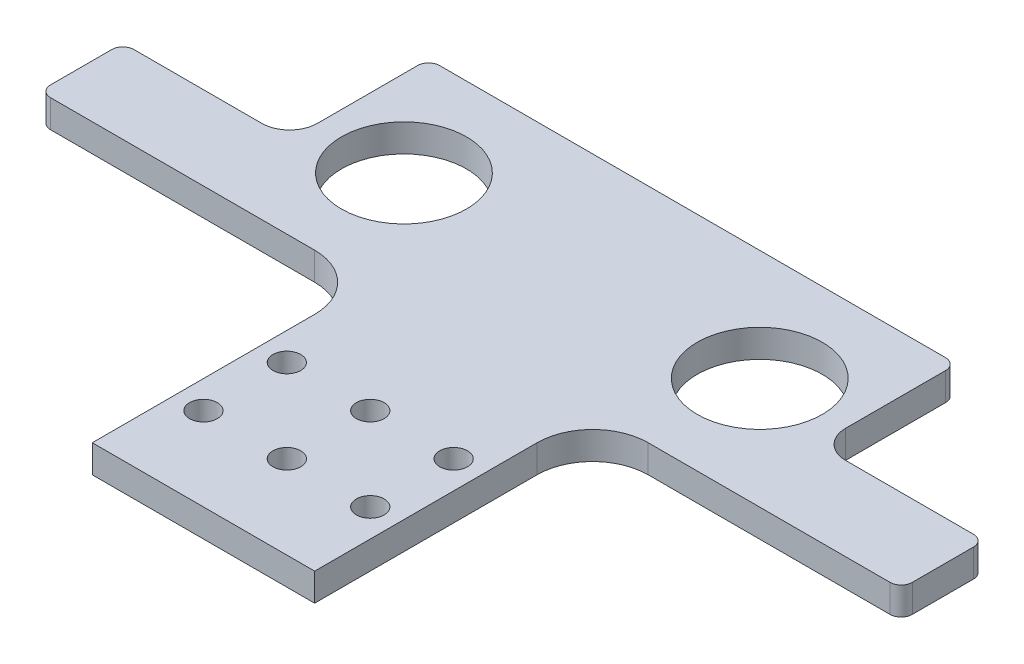
from build123d import *

# Parameters (mm, degrees)
SKETCH2_W            = 120.65
SKETCH2_H            = 50.8
BOSS_EXTRUDE1_DEPTH  = 6.35
SKETCH3_R            = 14.2875
CUT_EXTRUDE1_DEPTH   = 6.35
SKETCH6_W            = 38.1
SKETCH6_H            = 19.05
BOSS_EXTRUDE2_DEPTH  = 6.35
FILLET2_R            = 6.35
FILLET1_R            = 2.54
SKETCH8_W            = 50.8
SKETCH8_H            = 63.5
BOSS_EXTRUDE3_DEPTH  = 6.35
FILLET3_R            = 12.7
SKETCH9_R            = 3.175
CUT_EXTRUDE2_DEPTH   = 6.35
LPATTERN1_COUNT      = 3
LPATTERN1_PITCH      = 19.05
LPATTERN1_COUNT_DIR2 = 2
LPATTERN1_PITCH_DIR2 = 19.05


with BuildPart() as part:
    # Sketch2 → Boss-Extrude1 (new body)
    with BuildSketch(Plane(origin=(0, 0, 0), x_dir=(1, 0, 0), z_dir=(0, 1, 0))):
        with Locations((7.924270833, 15.531041667)):
            Rectangle(SKETCH2_W, SKETCH2_H)
    extrude(amount=BOSS_EXTRUDE1_DEPTH)

    # Sketch3 → Cut-Extrude1 (cut)
    with BuildSketch(Plane(origin=(0, 6.35, 0), x_dir=(1, 0, 0), z_dir=(0, 1, 0))):
        with Locations(Location((-32.715729167, 15.61478805, 0), (0, 0, 270))):
            Circle(SKETCH3_R)
    cut_extrude1 = extrude(amount=-CUT_EXTRUDE1_DEPTH, mode=Mode.SUBTRACT)

    # Mirror1: Cut-Extrude1 across plane
    add(cut_extrude1.mirror(Plane(origin=(7.924270833, 0, 0), x_dir=(0, 0, 1), z_dir=(1, 0, 0))), mode=Mode.SUBTRACT)

    # Sketch6 → Boss-Extrude2 (add)
    with BuildSketch(Plane(origin=(0, 6.35, 0), x_dir=(1, 0, 0), z_dir=(0, 1, 0))):
        with Locations((-71.450729167, -0.343958333)):
            Rectangle(SKETCH6_W, SKETCH6_H)
    boss_extrude2 = extrude(amount=-BOSS_EXTRUDE2_DEPTH)

    # Mirror2: Boss-Extrude2 across plane
    add(boss_extrude2.mirror(Plane(origin=(7.924270833, 0, 0), x_dir=(0, 0, 1), z_dir=(1, 0, 0))))

    # Fillet2
    fillet2_edges = [part.edges().sort_by_distance(p)[0] for p in [
        (-52.400729167, 3.175, -9.181041667),
        (68.249270833, 3.175, -9.181041667),
    ]]
    fillet(fillet2_edges, radius=FILLET2_R)

    # Fillet1
    fillet1_edges = [part.edges().sort_by_distance(p)[0] for p in [
        (-90.500729167, 3.175, 9.868958333),
        (-90.500729167, 3.175, -9.181041667),
        (106.349270833, 3.175, -9.181041667),
        (106.349270833, 3.175, 9.868958333),
        (-52.400729167, 3.175, -40.931041667),
        (68.249270833, 3.175, -40.931041667),
    ]]
    fillet(fillet1_edges, radius=FILLET1_R)

    # Sketch8 → Boss-Extrude3 (add)
    with BuildSketch(Plane(origin=(0, 6.35, 0), x_dir=(1, 0, 0), z_dir=(0, 1, 0))):
        with Locations((10.464270833, -41.618958333)):
            Rectangle(SKETCH8_W, SKETCH8_H)
    extrude(amount=-BOSS_EXTRUDE3_DEPTH)

    # Fillet3
    fillet3_edges = [part.edges().sort_by_distance(p)[0] for p in [
        (-14.935729167, 3.175, 9.868958333),
        (35.864270833, 3.175, 9.868958333),
    ]]
    fillet(fillet3_edges, radius=FILLET3_R)

    # Sketch9 → Cut-Extrude2 (cut)
    with BuildSketch(Plane(origin=(0, 6.35, 0), x_dir=(1, 0, 0), z_dir=(0, 1, 0))):
        with Locations(Location((-8.585729167, -54.318958333, 0), (0, 0, 270))):
            Circle(SKETCH9_R)
    cut_extrude2 = extrude(amount=-CUT_EXTRUDE2_DEPTH, mode=Mode.SUBTRACT)

    # LPattern1: Cut-Extrude2 3 × 2
    with Locations(*[(i * LPATTERN1_PITCH, 0, -j * LPATTERN1_PITCH_DIR2) for i in range(LPATTERN1_COUNT) for j in range(LPATTERN1_COUNT_DIR2) if (i, j) != (0, 0)]):
        add(cut_extrude2, mode=Mode.SUBTRACT)


solid = part.part
